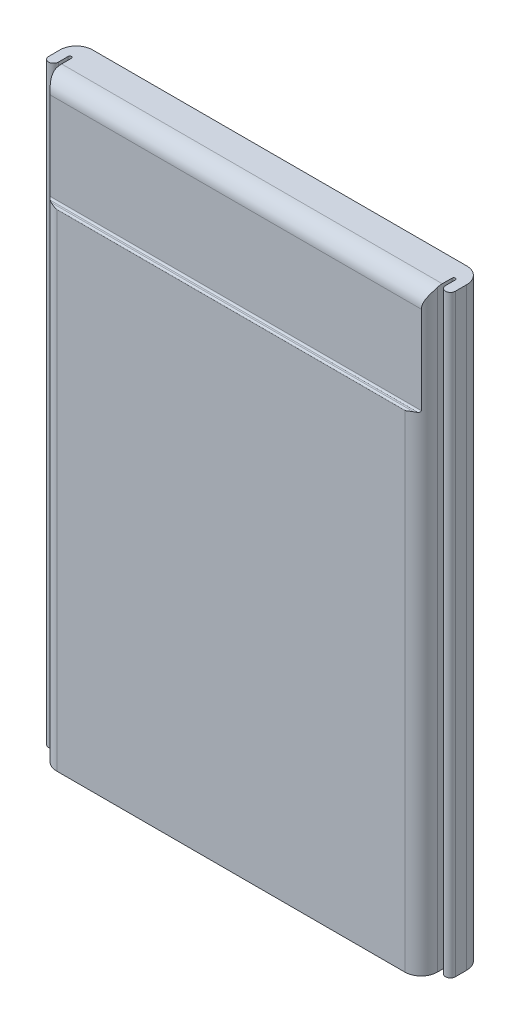
from build123d import *

# Parameters (mm, degrees)
EXTRUDE_1_DEPTH                 = 18.25
CUT_EXTRUDE_1_REACH             = 24.323
CUT_EXTRUDE_1_DIRECTION_2_REACH = 24.323


with BuildPart() as part:
    # Эскиз1 → Бобышка-Вытянуть1 (new, symmetric)
    with BuildSketch(Plane(origin=(0, 0, 0), x_dir=(1, 0, 0), z_dir=(0, 1, 0))):
        with BuildLine():
            Line((-11.5, 0), (11.5, 0))
            ThreePointArc((11.5, 0), (12.207106781, -0.292893219), (12.5, -1))
            Line((12.5, -1), (12.5, -1.7))
            ThreePointArc((12.5, -1.7), (12.2, -2), (11.9, -1.7))
            Line((11.9, -1.7), (11.9, -1.1))
            ThreePointArc((11.9, -1.1), (11.8, -1), (11.7, -1.1))
            Line((11.7, -1.1), (11.7, -2))
            ThreePointArc((11.7, -2), (11.407106781, -2.707106781), (10.7, -3))
            Line((10.7, -3), (-10.7, -3))
            ThreePointArc((-10.7, -3), (-11.407106781, -2.707106781), (-11.7, -2))
            Line((-11.7, -2), (-11.7, -1.1))
            ThreePointArc((-11.7, -1.1), (-11.8, -1), (-11.9, -1.1))
            Line((-11.9, -1.1), (-11.9, -1.7))
            ThreePointArc((-11.9, -1.7), (-12.2, -2), (-12.5, -1.7))
            Line((-12.5, -1.7), (-12.5, -1))
            ThreePointArc((-12.5, -1), (-12.207106781, -0.292893219), (-11.5, 0))
        make_face()
    extrude(amount=EXTRUDE_1_DEPTH, both=True)

    # Эскиз2 → Вырез-Вытянуть1 (cut, up to next)
    with BuildSketch(Plane(origin=(0, 0, 0), x_dir=(0, 0, -1), z_dir=(1, 0, 0)), mode=Mode.PRIVATE) as cut_extrude_1_sk1:
        with BuildLine():
            Line((-2.7, 17.25), (-2.7, 11.85))
            ThreePointArc((-2.7, 11.85), (-2.729289322, 11.779289322), (-2.8, 11.75))
            Line((-2.8, 11.75), (-2.9, 11.75))
            ThreePointArc((-2.9, 11.75), (-2.970710678, 11.720710678), (-3, 11.65))
            Line((-3, 11.65), (-3, 18.25))
            Line((-3, 18.25), (-1.7, 18.25))
            ThreePointArc((-1.7, 18.25), (-2.407106781, 17.957106781), (-2.7, 17.25))
        make_face()
    cut_extrude_1_tool1 = extrude(cut_extrude_1_sk1.sketch, amount=-CUT_EXTRUDE_1_REACH, mode=Mode.PRIVATE) & part.part
    add(cut_extrude_1_tool1.solids().sort_by_distance((0, 15.300021, 2.813237))[0], mode=Mode.SUBTRACT)

    # Эскиз2 → Вырез-Вытянуть1 direction 2 (cut, up to next)
    with BuildSketch(Plane(origin=(0, 0, 0), x_dir=(0, 0, -1), z_dir=(1, 0, 0)), mode=Mode.PRIVATE) as cut_extrude_1_direction_2_sk1:
        with BuildLine():
            Line((-2.7, 17.25), (-2.7, 11.85))
            ThreePointArc((-2.7, 11.85), (-2.729289322, 11.779289322), (-2.8, 11.75))
            Line((-2.8, 11.75), (-2.9, 11.75))
            ThreePointArc((-2.9, 11.75), (-2.970710678, 11.720710678), (-3, 11.65))
            Line((-3, 11.65), (-3, 18.25))
            Line((-3, 18.25), (-1.7, 18.25))
            ThreePointArc((-1.7, 18.25), (-2.407106781, 17.957106781), (-2.7, 17.25))
        make_face()
    cut_extrude_1_direction_2_tool1 = extrude(cut_extrude_1_direction_2_sk1.sketch, amount=CUT_EXTRUDE_1_DIRECTION_2_REACH, mode=Mode.PRIVATE) & part.part
    add(cut_extrude_1_direction_2_tool1.solids().sort_by_distance((0, 15.300021, 2.813237))[0], mode=Mode.SUBTRACT)


solid = part.part
